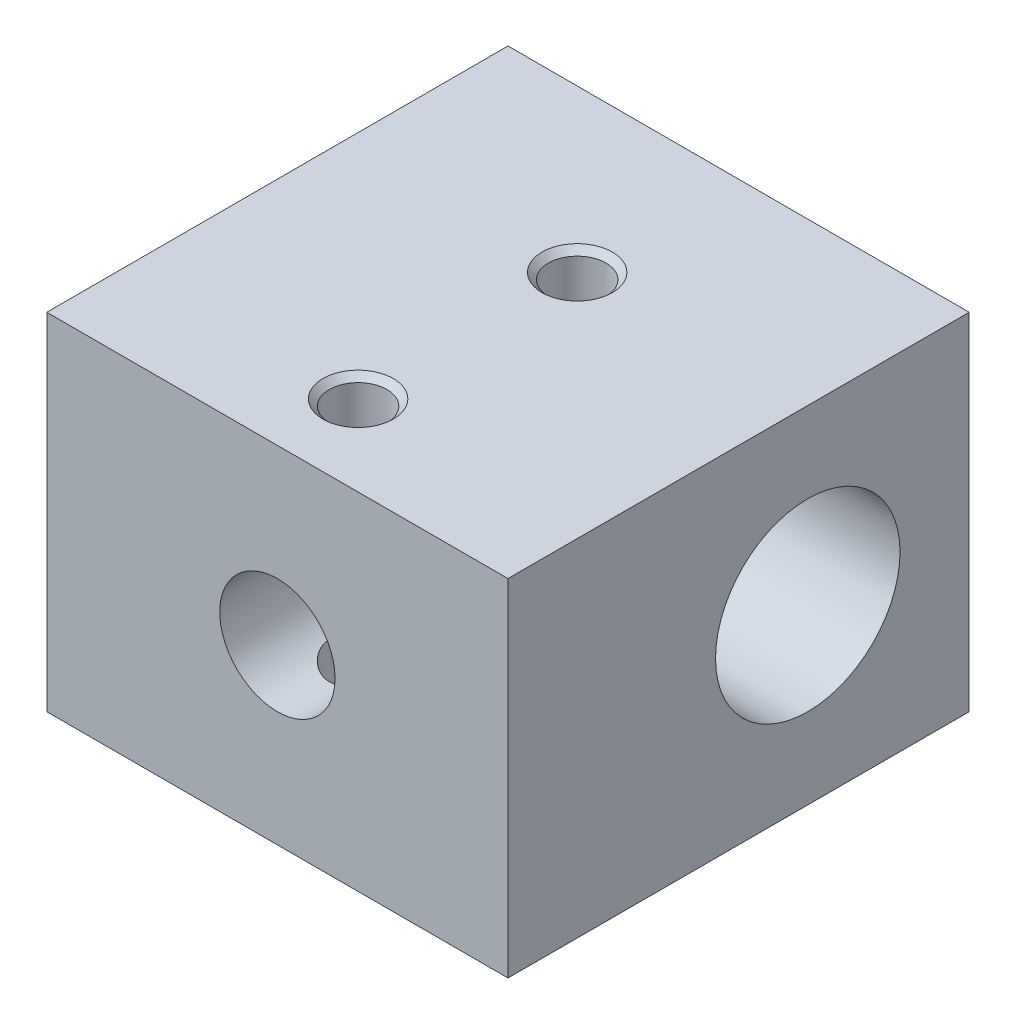
from build123d import *

# Parameters (mm, degrees)
SKIZZE1_W                          = 20
SKIZZE1_H                          = 20
AUFSATZ_LINEAR_AUSTRAGEN1_DEPTH    = 15
SKIZZE2_R                          = 2.5
SCHNITT_LINEAR_AUSTRAGEN1_DEPTH    = 7
SKIZZE4_R                          = 4
SCHNITT_LINEAR_AUSTRAGEN7_DEPTH    = 33.015621187
M3X0_5_GEWINDEBOHRUNG1_D           = 2.5
M3X0_5_GEWINDEBOHRUNG1_CSINK_D     = 3.05
M3X0_5_GEWINDEBOHRUNG1_CSINK_ANGLE = 90


with BuildPart() as part:
    # Skizze1 → Aufsatz-Linear austragen1 (new body)
    with BuildSketch(Plane(origin=(0, 0, 0), x_dir=(1, 0, 0), z_dir=(0, 1, 0))):
        with Locations((10, 10)):
            Rectangle(SKIZZE1_W, SKIZZE1_H)
    extrude(amount=AUFSATZ_LINEAR_AUSTRAGEN1_DEPTH)

    # Skizze2 → Schnitt-Linear austragen1 (cut)
    with BuildSketch(Plane.XY):
        with Locations((10, 7.5)):
            Circle(SKIZZE2_R)
    extrude(amount=-SCHNITT_LINEAR_AUSTRAGEN1_DEPTH, mode=Mode.SUBTRACT)

    # Skizze4 → Schnitt-Linear austragen7 (cut, through all)
    with BuildSketch(Plane(origin=(20, 0, 0), x_dir=(0, 0, -1), z_dir=(1, 0, 0))):
        with Locations((13, 7.5)):
            Circle(SKIZZE4_R)
    extrude(amount=-SCHNITT_LINEAR_AUSTRAGEN7_DEPTH, mode=Mode.SUBTRACT)

    # M3x0.5 Gewindebohrung1 (through all)
    with Locations(Plane(origin=(12, 15, 0), x_dir=(0, 0, 1), z_dir=(0, 1, 0))):
        with Locations((-3.5, -2), (-13, -2)):
            CounterSinkHole(M3X0_5_GEWINDEBOHRUNG1_D / 2, M3X0_5_GEWINDEBOHRUNG1_CSINK_D / 2, counter_sink_angle=M3X0_5_GEWINDEBOHRUNG1_CSINK_ANGLE)


solid = part.part
